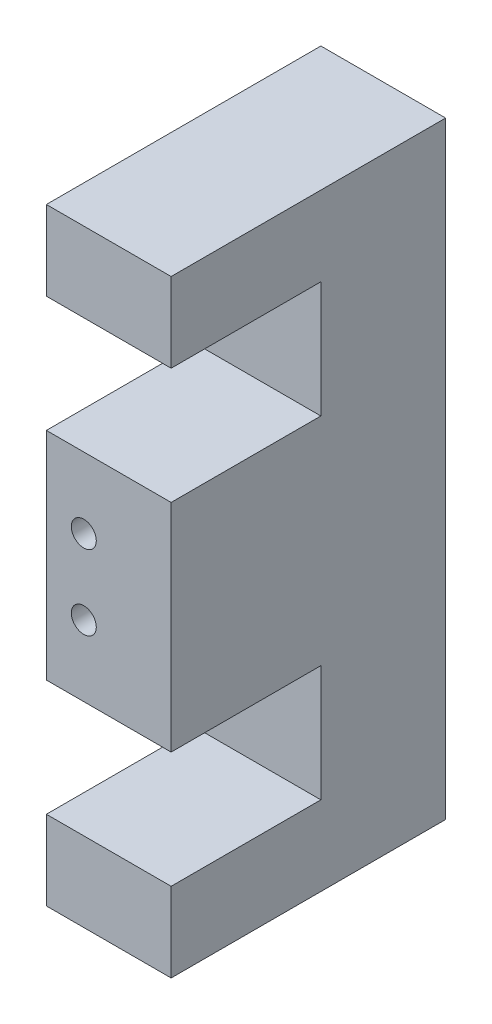
from build123d import *

# Parameters (mm, degrees)
BOSS_EXTRUDE1_START = -4
SKETCH2_W           = 12.7
SKETCH2_H           = 11.829112303
SKETCH2_H_2         = 8.085443848
BOSS_EXTRUDE1_DEPTH = 12.7
BOSS_EXTRUDE3_START = -4
SKETCH2_4_W         = 12.7
SKETCH2_4_H         = 8.085443848
BOSS_EXTRUDE3_DEPTH = 15.24
SKETCH3_R           = 1.778
CUT_EXTRUDE1_DEPTH  = 7.62
SKETCH3_3_R         = 1.27
CUT_EXTRUDE2_DEPTH  = 66.423141131


with BuildPart() as part:
    # Sketch2 → Boss-Extrude1 (new body)
    with BuildSketch(Plane.XY.offset(BOSS_EXTRUDE1_START)):
        with BuildLine():
            Line((34.8, 12), (34.8, 14))
            Line((34.8, 14), (22.1, 14))
            Line((22.1, 14), (22.1, 5.914556152))
            Line((22.1, 5.914556152), (32.8, 5.914556152))
            ThreePointArc((32.8, 5.914556152), (34.214213562, 6.500342589), (34.8, 7.914556152))
            Line((34.8, 7.914556152), (34.8, 12))
        make_face()
        Polygon((32.8, 5.914556152), (22.1, 5.914556152), (22.1, -5.914556152), (32.8, -5.914556152), (34.8, -5.914556152), (34.8, 5.914556152), align=None)
        with BuildLine():
            Line((32.8, -5.914556152), (22.1, -5.914556152))
            Line((22.1, -5.914556152), (22.1, -27.923752717))
            Line((22.1, -27.923752717), (34.8, -27.923752717))
            Line((34.8, -27.923752717), (34.8, -12))
            Line((34.8, -12), (34.8, -7.914556152))
            ThreePointArc((34.8, -7.914556152), (34.214213562, -6.500342589), (32.8, -5.914556152))
        make_face()
        with Locations((28.45, -33.838308869)):
            Rectangle(SKETCH2_W, SKETCH2_H)
        with Locations((28.45, -43.795586944)):
            Rectangle(SKETCH2_W, SKETCH2_H_2)
        with BuildLine():
            Line((34.8, 5.914556152), (34.8, 7.914556152))
            ThreePointArc((34.8, 7.914556152), (34.214213562, 6.500342589), (32.8, 5.914556152))
            Line((32.8, 5.914556152), (34.8, 5.914556152))
        make_face()
        with BuildLine():
            Line((34.8, -5.914556152), (32.8, -5.914556152))
            ThreePointArc((32.8, -5.914556152), (34.214213562, -6.500342589), (34.8, -7.914556152))
            Line((34.8, -7.914556152), (34.8, -5.914556152))
        make_face()
    extrude(amount=-BOSS_EXTRUDE1_DEPTH)

    # Sketch2<4> → Boss-Extrude3 (add)
    with BuildSketch(Plane.XY.offset(BOSS_EXTRUDE3_START)):
        with BuildLine():
            Line((34.8, 12), (34.8, 14))
            Line((34.8, 14), (22.1, 14))
            Line((22.1, 14), (22.1, 5.914556152))
            Line((22.1, 5.914556152), (32.8, 5.914556152))
            ThreePointArc((32.8, 5.914556152), (34.214213562, 6.500342589), (34.8, 7.914556152))
            Line((34.8, 7.914556152), (34.8, 12))
        make_face()
        with BuildLine():
            Line((34.8, 5.914556152), (34.8, 7.914556152))
            ThreePointArc((34.8, 7.914556152), (34.214213562, 6.500342589), (32.8, 5.914556152))
            Line((32.8, 5.914556152), (34.8, 5.914556152))
        make_face()
        with BuildLine():
            Line((32.8, -5.914556152), (22.1, -5.914556152))
            Line((22.1, -5.914556152), (22.1, -27.923752717))
            Line((22.1, -27.923752717), (34.8, -27.923752717))
            Line((34.8, -27.923752717), (34.8, -12))
            Line((34.8, -12), (34.8, -7.914556152))
            ThreePointArc((34.8, -7.914556152), (34.214213562, -6.500342589), (32.8, -5.914556152))
        make_face()
        with BuildLine():
            Line((34.8, -5.914556152), (32.8, -5.914556152))
            ThreePointArc((32.8, -5.914556152), (34.214213562, -6.500342589), (34.8, -7.914556152))
            Line((34.8, -7.914556152), (34.8, -5.914556152))
        make_face()
        with Locations((28.45, -43.795586944)):
            Rectangle(SKETCH2_4_W, SKETCH2_4_H)
    extrude(amount=BOSS_EXTRUDE3_DEPTH)

    # Sketch3 → Cut-Extrude1 (cut)
    with BuildSketch(Plane(origin=(0, 0, -16.7), x_dir=(-1, 0, 0), z_dir=(0, 0, -1))):
        with Locations((-29.72, -16.919154434)):
            Circle(SKETCH3_R)
    extrude(amount=-CUT_EXTRUDE1_DEPTH, mode=Mode.SUBTRACT)

    # Sketch3<3> → Cut-Extrude2 (cut, through all)
    with BuildSketch(Plane(origin=(0, 0, -16.7), x_dir=(-1, 0, 0), z_dir=(0, 0, -1))):
        with Locations((-25.91, -13.109154434)):
            Circle(SKETCH3_3_R)
        with Locations((-25.91, -20.729154434)):
            Circle(SKETCH3_3_R)
    extrude(amount=-CUT_EXTRUDE2_DEPTH, mode=Mode.SUBTRACT)


solid = part.part
